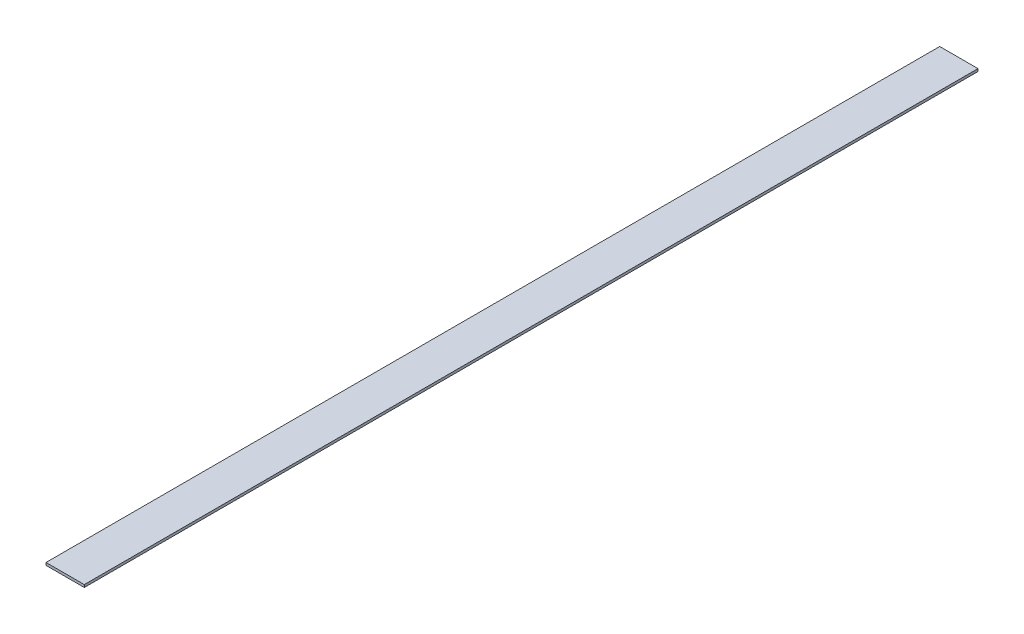
from build123d import *

# Parameters (mm, degrees)
SKETCH1_W           = 15
SKETCH1_H           = 1
BOSS_EXTRUDE1_DEPTH = 350


with BuildPart() as part:
    # Sketch1 → Boss-Extrude1 (new body)
    with BuildSketch(Plane.XY):
        Rectangle(SKETCH1_W, SKETCH1_H)
    extrude(amount=BOSS_EXTRUDE1_DEPTH)


solid = part.part
